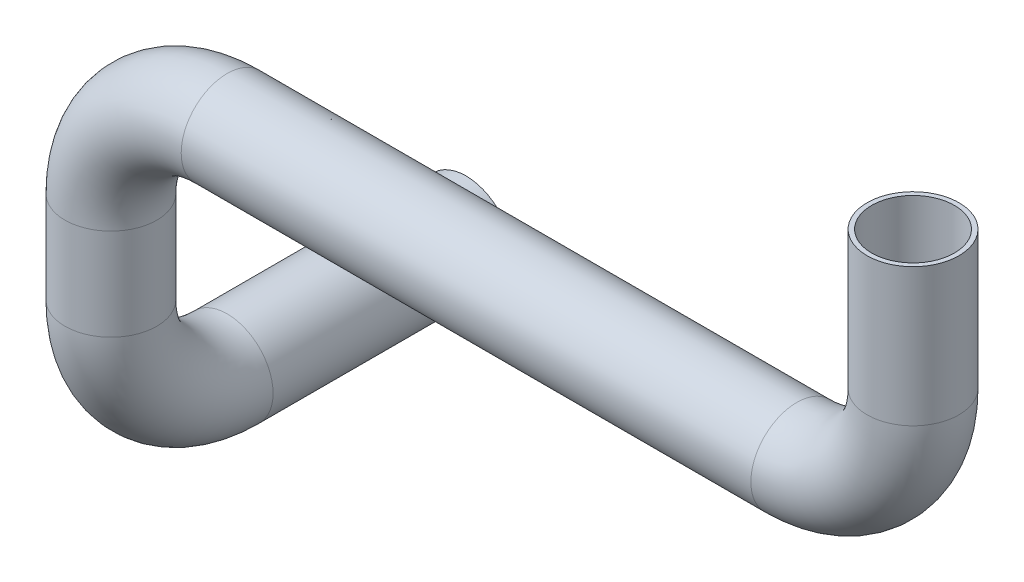
from build123d import *

# Parameters (mm, degrees)
SKETCH1_R = 5
SKETCH3_R = 5
SHELL1_T  = -0.5


with BuildPart() as part:
    # Sweep1: sweep along a path in Sketch2
    with BuildLine(Plane.XY) as sweep1_path:
        Line((0, 0), (0, 10))
        ThreePointArc((0, 10), (3.705099218, 18.944900782), (12.65, 22.65))
        Line((12.65, 22.65), (74.65, 22.65))
        ThreePointArc((74.65, 22.65), (83.594900782, 26.355099218), (87.3, 35.3))
        Line((87.3, 35.3), (87.3, 50.3))
    # Sketch1 → Sweep1 (sweep)
    with BuildSketch(Plane(origin=(0, 0, 0), x_dir=(1, 0, 0), z_dir=(0, 1, 0))):
        Circle(SKETCH1_R)
    sweep(path=sweep1_path.line)

    # Sweep2: sweep along a path in Sketch5
    with BuildLine(Plane(origin=(0, 0, 0), x_dir=(0, 0, -1), z_dir=(1, 0, 0))) as sweep2_path:
        Line((38.65, -12.65), (12.65, -12.65))
        ThreePointArc((12.65, -12.65), (3.705099218, -8.944900782), (0, 0))
    # Sketch3 → Sweep2 (sweep)
    with BuildSketch(Plane.XZ):
        Circle(SKETCH3_R)
    sweep(path=sweep2_path.line)

    # Shell1
    shell1_openings = [part.faces().sort_by_distance(p)[0] for p in [
        (0, -12.65, -38.65),
        (87.3, 50.3, 0),
    ]]
    offset(amount=SHELL1_T, openings=shell1_openings, kind=Kind.INTERSECTION)


solid = part.part
